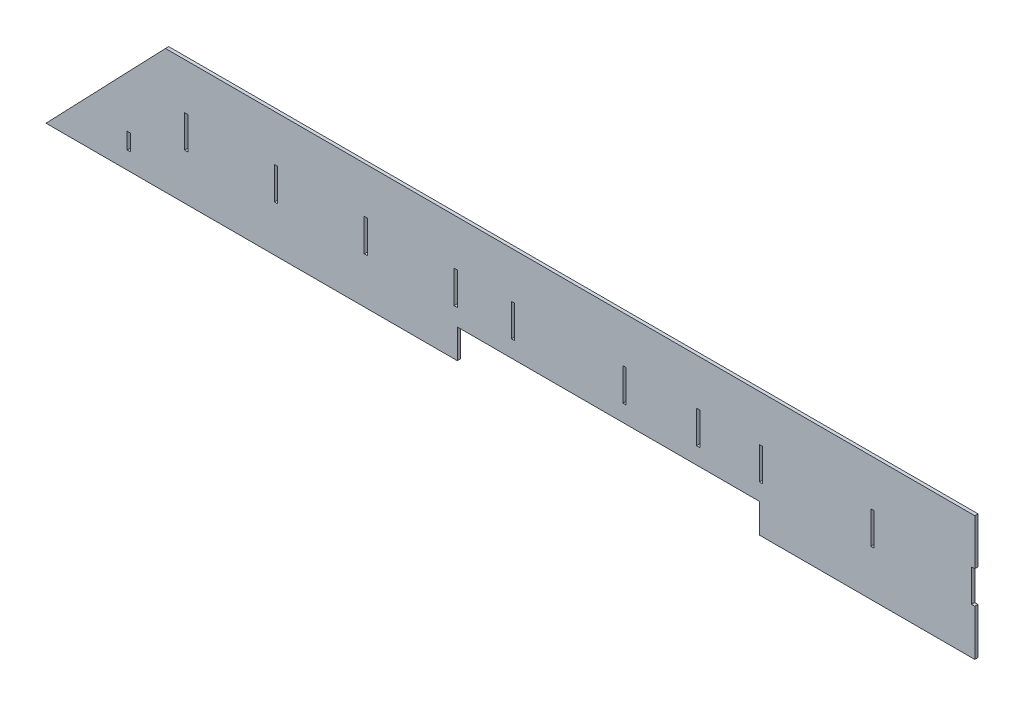
from build123d import *

# Parameters (mm, degrees)
SKETCH1_W           = 3
SKETCH1_H           = 15
SKETCH1_H_2         = 30
BOSS_EXTRUDE1_DEPTH = 3
SKETCH2_W           = 279
SKETCH2_H           = 27
CUT_EXTRUDE1_DEPTH  = 10


with BuildPart() as part:
    # Sketch1 → Boss-Extrude1 (new body)
    with BuildSketch(Plane.XY):
        Polygon((110.35106383, 115), (0, 0), (858, 0), (858, 42.5), (855, 42.5), (855, 72.5), (858, 72.5), (858, 115), align=None)
        with Locations((76.5, 23.609115303)):
            Rectangle(SKETCH1_W, SKETCH1_H, mode=Mode.SUBTRACT)
        with Locations((129.5, 57.5)):
            Rectangle(SKETCH1_W, SKETCH1_H_2, mode=Mode.SUBTRACT)
        with Locations((212.5, 57.5)):
            Rectangle(SKETCH1_W, SKETCH1_H_2, mode=Mode.SUBTRACT)
        with Locations((295.5, 57.5)):
            Rectangle(SKETCH1_W, SKETCH1_H_2, mode=Mode.SUBTRACT)
        with Locations((378.5, 57.5)):
            Rectangle(SKETCH1_W, SKETCH1_H_2, mode=Mode.SUBTRACT)
        with Locations((431.5, 57.5)):
            Rectangle(SKETCH1_W, SKETCH1_H_2, mode=Mode.SUBTRACT)
        with Locations((534.5, 57.5)):
            Rectangle(SKETCH1_W, SKETCH1_H_2, mode=Mode.SUBTRACT)
        with Locations((602.5, 57.5)):
            Rectangle(SKETCH1_W, SKETCH1_H_2, mode=Mode.SUBTRACT)
        with Locations((660.5, 57.5)):
            Rectangle(SKETCH1_W, SKETCH1_H_2, mode=Mode.SUBTRACT)
        with Locations((763.5, 57.5)):
            Rectangle(SKETCH1_W, SKETCH1_H_2, mode=Mode.SUBTRACT)
    extrude(amount=BOSS_EXTRUDE1_DEPTH)

    # Sketch2 → Cut-Extrude1 (cut)
    with BuildSketch(Plane.XY.offset(3)):
        with Locations((519.5, 13.5)):
            Rectangle(SKETCH2_W, SKETCH2_H)
    extrude(amount=-CUT_EXTRUDE1_DEPTH, mode=Mode.SUBTRACT)


solid = part.part
